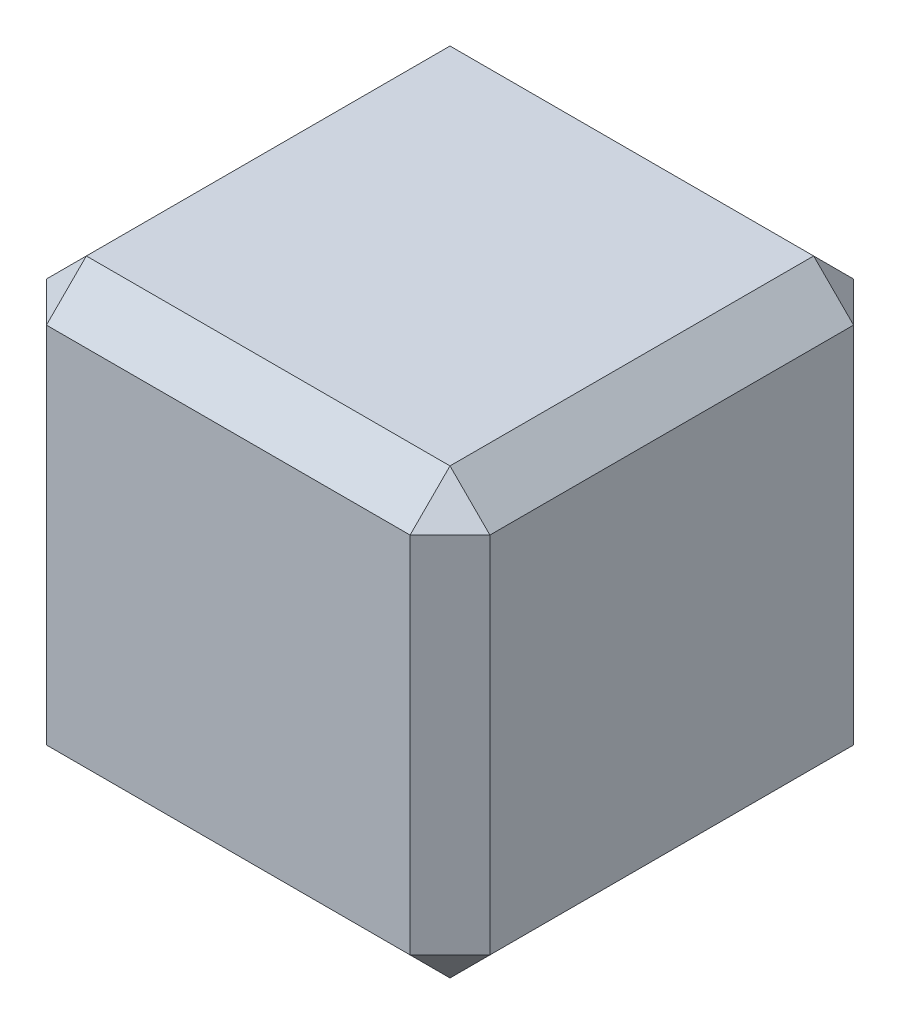
from build123d import *

# Parameters (mm, degrees)
SKETCH_1_W      = 200
SKETCH_1_H      = 200
EXTRUDE_1_DEPTH = 100
CHAMFER_1_SIZE  = 18


with BuildPart() as part:
    # 草图1 → 凸台-拉伸1 (new, symmetric)
    with BuildSketch(Plane.XY):
        Rectangle(SKETCH_1_W, SKETCH_1_H)
    extrude(amount=EXTRUDE_1_DEPTH, both=True)

    # 倒角1
    chamfer_1_edges = [part.edges().sort_by_distance(p)[0] for p in [
        (-100, 0, 100),
        (0, -100, 100),
        (100, 0, 100),
        (0, -100, -100),
        (-100, 0, -100),
        (0, 100, -100),
        (100, 0, -100),
        (100, -100, 0),
        (-100, -100, 0),
        (-100, 100, 0),
        (100, 100, 0),
        (0, 100, 100),
    ]]
    chamfer(chamfer_1_edges, length=CHAMFER_1_SIZE)


solid = part.part
